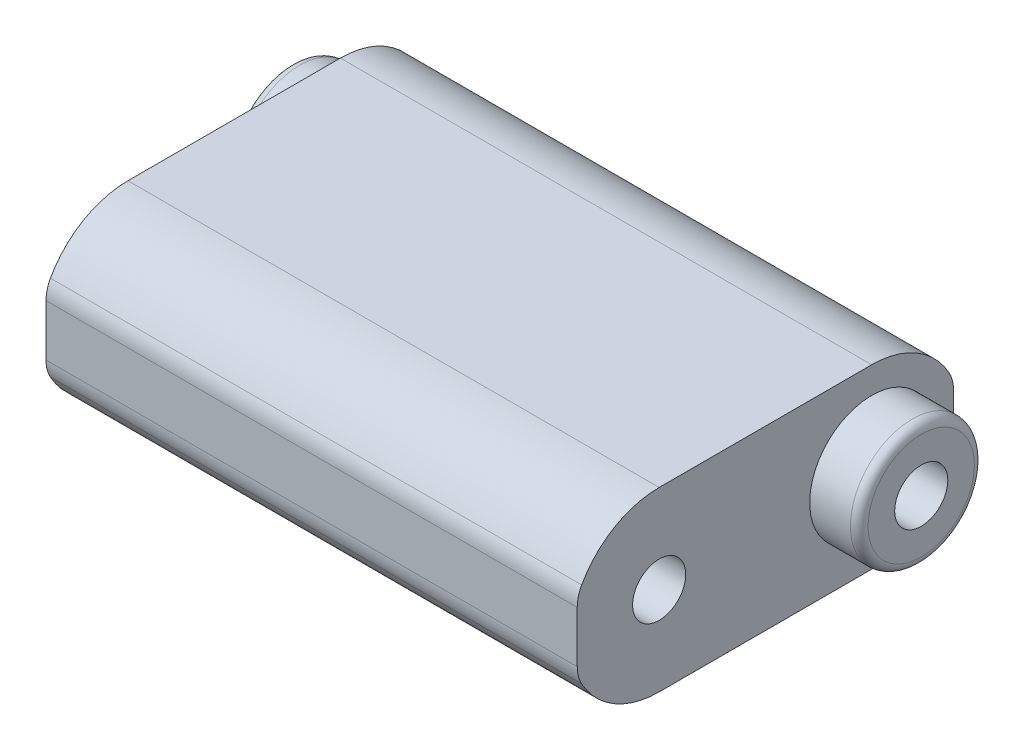
from build123d import *

# Parameters (mm, degrees)
SKETCH_2_W          = 120
SKETCH_2_H          = 100
EXTRUDE_1_DEPTH     = 300
SKETCH_3_R          = 15
CUT_EXTRUDE_1_DEPTH = 300
EXTRUDE_START       = 28
SKETCH_4_R          = 35
SKETCH_4_R_2        = 15
EXTRUDE_2_DEPTH     = 28
SKETCH_6_R          = 35
SKETCH_6_R_2        = 15
EXTRUDE_3_DEPTH     = 28
FILLET_2_R          = 5
FILLET_3_R          = 20


with BuildPart() as part:
    # 草图2 → 凸台-拉伸1 (new body)
    with BuildSketch(Plane(origin=(0, 0, 0), x_dir=(0, 0, -1), z_dir=(1, 0, 0))):
        with BuildLine():
            Line((106.249324319, 19), (106.249324319, -19))
            ThreePointArc((106.249324319, -19), (10, 0), (106.249324319, 19))
        make_face()
        Rectangle(SKETCH_2_W, SKETCH_2_H)
        with BuildLine():
            Line((-106.249324319, 19), (-106.249324319, -19))
            ThreePointArc((-106.249324319, -19), (-10, 0), (-106.249324319, 19))
        make_face()
    extrude(amount=EXTRUDE_1_DEPTH)

    # 草图3 → 切除-拉伸1 (cut)
    with BuildSketch(Plane.ZY):
        with Locations((60, 0)):
            Circle(SKETCH_3_R)
        with Locations((-60, 0)):
            Circle(SKETCH_3_R)
    extrude(amount=-CUT_EXTRUDE_1_DEPTH, mode=Mode.SUBTRACT)

    # 草图4 → 凸台-拉伸2 (add)
    with BuildSketch(Plane.ZY.offset(EXTRUDE_START)):
        with Locations(Location((-60, 0, 0), (0, 0, 180))):
            Circle(SKETCH_4_R)
        with Locations((-60, 0)):
            Circle(SKETCH_4_R_2, mode=Mode.SUBTRACT)
    extrude(amount=-EXTRUDE_2_DEPTH)

    # 草图6 → 凸台-拉伸3 (add)
    with BuildSketch(Plane(origin=(300, 0, 0), x_dir=(0, 0, -1), z_dir=(1, 0, 0))):
        with Locations((60, 0)):
            Circle(SKETCH_6_R)
        with Locations(Location((60, 0, 0), (0, 0, 180))):
            Circle(SKETCH_6_R_2, mode=Mode.SUBTRACT)
    extrude(amount=EXTRUDE_3_DEPTH)

    # 圆角2
    fillet_2_edges = [part.edges().sort_by_distance(p)[0] for p in [
        (-28, 0, -25),
        (328, 0, -25),
    ]]
    fillet(fillet_2_edges, radius=FILLET_2_R)

    # 圆角3
    fillet_3_edges = [part.edges().sort_by_distance(p)[0] for p in [
        (150, -19, 106.249324319),
        (150, 19, 106.249324319),
        (150, 19, -106.249324319),
        (150, -19, -106.249324319),
    ]]
    fillet(fillet_3_edges, radius=FILLET_3_R)


solid = part.part
